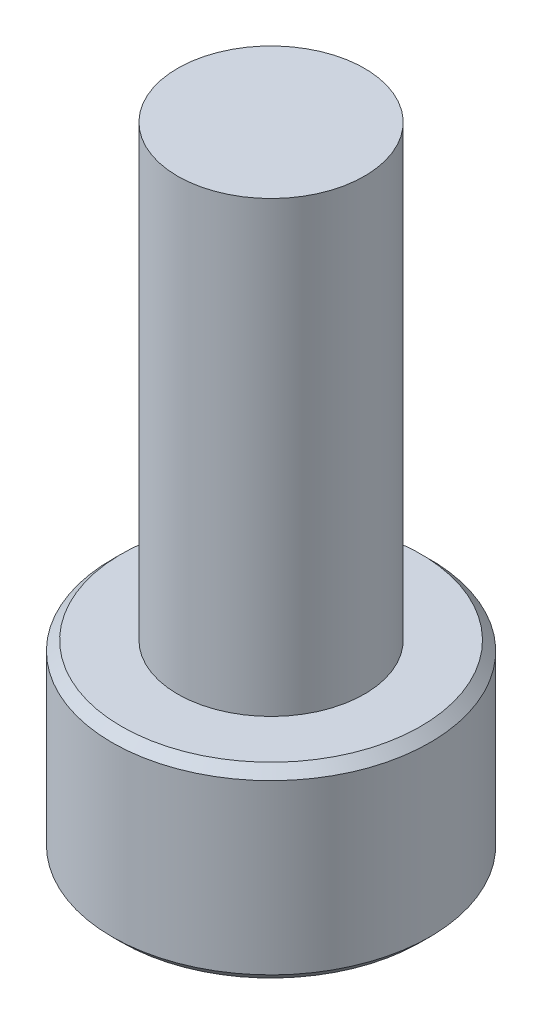
from build123d import *

# Parameters (mm, degrees)
SKETCH_1_R          = 4.25
EXTRUDE_1_DEPTH     = 5
SKETCH_2_R          = 2.5
EXTRUDE_2_DEPTH     = 12
CUT_EXTRUDE_START   = -5
CUT_EXTRUDE_1_DEPTH = 2.5
CHAMFER_1_SIZE      = 0.25


with BuildPart() as part:
    # 草图1 → 凸台-拉伸1 (new body)
    with BuildSketch(Plane(origin=(0, 0, 0), x_dir=(1, 0, 0), z_dir=(0, 1, 0))):
        with Locations(Location((0, 0, 0), (0, 0, 270))):
            Circle(SKETCH_1_R)
    extrude(amount=-EXTRUDE_1_DEPTH)

    # 草图2 → 凸台-拉伸2 (add)
    with BuildSketch(Plane(origin=(0, 0, 0), x_dir=(1, 0, 0), z_dir=(0, 1, 0))):
        with Locations(Location((0, 0, 0), (0, 0, 270))):
            Circle(SKETCH_2_R)
    extrude(amount=EXTRUDE_2_DEPTH)

    # 草图3 → 切除-拉伸1 (cut)
    with BuildSketch(Plane(origin=(0, 0, 0), x_dir=(1, 0, 0), z_dir=(0, 1, 0)).offset(CUT_EXTRUDE_START)):
        Polygon((2, -1.154700538), (2, 1.154700538), (0, 2.309401077), (-2, 1.154700538), (-2, -1.154700538), (0, -2.309401077), align=None)
    extrude(amount=CUT_EXTRUDE_1_DEPTH, mode=Mode.SUBTRACT)

    # 倒角1
    chamfer_1_edges = [part.edges().sort_by_distance(p)[0] for p in [
        (0, 0, -4.25),
        (0, -5, -4.25),
    ]]
    chamfer(chamfer_1_edges, length=CHAMFER_1_SIZE)


solid = part.part
